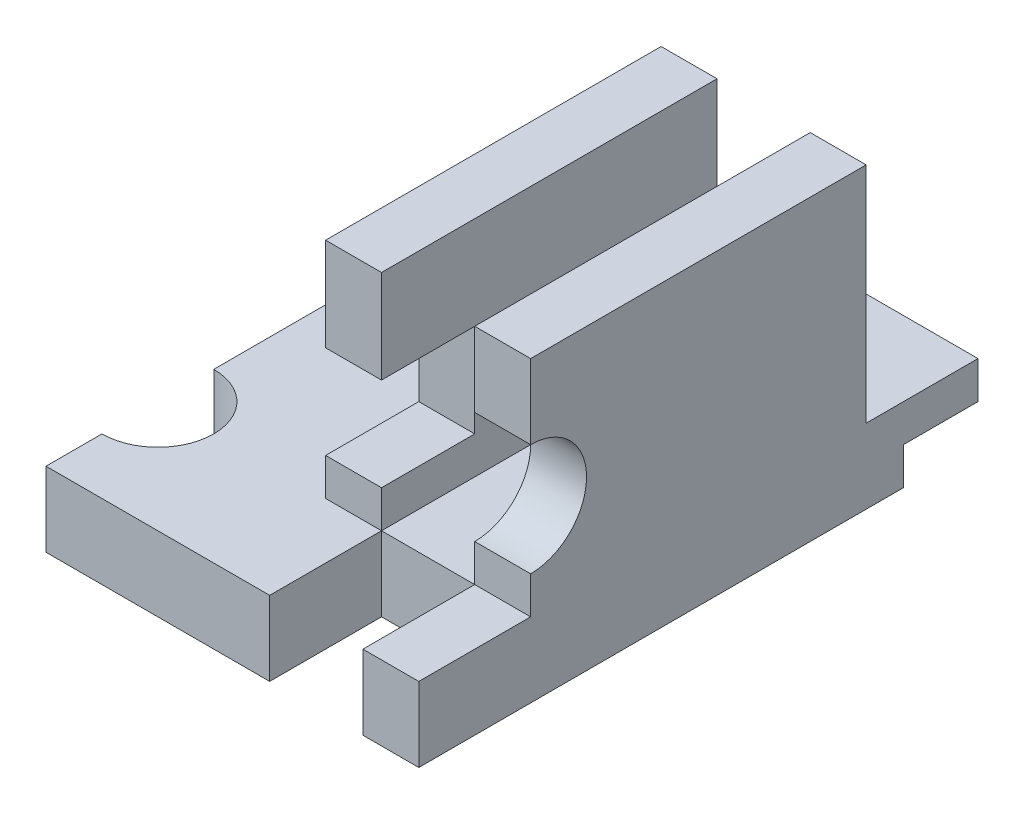
from build123d import *

# Parameters (mm, degrees)
SKETCH_1_W          = 100
SKETCH_1_H          = 150
EXTRUDE_1_DEPTH     = 20
SKETCH_2_R          = 15
CUT_EXTRUDE_1_DEPTH = 20
SKETCH_3_W          = 25
SKETCH_3_H          = 30
CUT_EXTRUDE_2_DEPTH = 20
SKETCH_4_W          = 15
SKETCH_4_H          = 90
EXTRUDE_2_DEPTH     = 60
SKETCH_6_W          = 15
SKETCH_6_H          = 90
EXTRUDE_3_DEPTH     = 60
CUT_EXTRUDE_3_REACH = 140.654
CUT_EXTRUDE_4_REACH = 112.68
SKETCH_9_W          = 25
SKETCH_9_H          = 25
SKETCH_10_W         = 20
SKETCH_10_H         = 10
CUT_EXTRUDE_5_DEPTH = 139.654246239


with BuildPart() as part:
    # Эскиз1 → Бобышка-Вытянуть1 (new body)
    with BuildSketch(Plane(origin=(0, 0, 0), x_dir=(1, 0, 0), z_dir=(0, 1, 0))):
        Rectangle(SKETCH_1_W, SKETCH_1_H)
    extrude(amount=-EXTRUDE_1_DEPTH)

    # Эскиз2 → Вырез-Вытянуть1 (cut)
    with BuildSketch(Plane(origin=(0, 0, 0), x_dir=(1, 0, 0), z_dir=(0, 1, 0))):
        with Locations((-50, -45)):
            Circle(SKETCH_2_R)
    extrude(amount=-CUT_EXTRUDE_1_DEPTH, mode=Mode.SUBTRACT)

    # Эскиз3 → Вырез-Вытянуть2 (cut)
    with BuildSketch(Plane(origin=(0, 0, 0), x_dir=(1, 0, 0), z_dir=(0, 1, 0))):
        with Locations((22.5, -60)):
            Rectangle(SKETCH_3_W, SKETCH_3_H)
    extrude(amount=-CUT_EXTRUDE_2_DEPTH, mode=Mode.SUBTRACT)

    # Эскиз4 → Бобышка-Вытянуть2 (add)
    with BuildSketch(Plane(origin=(0, 0, 0), x_dir=(1, 0, 0), z_dir=(0, 1, 0))):
        with Locations((2.5, 0)):
            Rectangle(SKETCH_4_W, SKETCH_4_H)
    extrude(amount=EXTRUDE_2_DEPTH)

    # Эскиз6 → Бобышка-Вытянуть3 (add)
    with BuildSketch(Plane(origin=(0, 0, 0), x_dir=(1, 0, 0), z_dir=(0, 1, 0))):
        with Locations((42.5, 0)):
            Rectangle(SKETCH_6_W, SKETCH_6_H)
    extrude(amount=EXTRUDE_3_DEPTH)

    # Эскиз7 → Вырез-Вытянуть3 (cut, up to next)
    with BuildSketch(Plane(origin=(50, 0, 0), x_dir=(0, 0, -1), z_dir=(1, 0, 0)), mode=Mode.PRIVATE) as cut_extrude_3_sk1:
        with BuildLine():
            Line((-45, 40), (-45, 10))
            ThreePointArc((-45, 10), (-30, 25), (-45, 40))
        make_face()
    cut_extrude_3_tool1 = extrude(cut_extrude_3_sk1.sketch, amount=-CUT_EXTRUDE_3_REACH, mode=Mode.PRIVATE) & part.part
    add(cut_extrude_3_tool1.solids().sort_by_distance((50, 25, 38.633802))[0], mode=Mode.SUBTRACT)

    # Эскиз9 → Вырез-Вытянуть4 (cut, up to next)
    with BuildSketch(Plane.ZY.offset(5), mode=Mode.PRIVATE) as cut_extrude_4_sk1:
        with Locations((32.5, 22.5)):
            Rectangle(SKETCH_9_W, SKETCH_9_H)
    cut_extrude_4_tool1 = extrude(cut_extrude_4_sk1.sketch, amount=-CUT_EXTRUDE_4_REACH, mode=Mode.PRIVATE) & part.part
    add(cut_extrude_4_tool1.solids().sort_by_distance((-5, 22.5, 32.5))[0], mode=Mode.SUBTRACT)

    # Эскиз10 → Вырез-Вытянуть5 (cut, through all)
    with BuildSketch(Plane(origin=(50, 0, 0), x_dir=(0, 0, -1), z_dir=(1, 0, 0))):
        with Locations((65, -15)):
            Rectangle(SKETCH_10_W, SKETCH_10_H)
    extrude(amount=-CUT_EXTRUDE_5_DEPTH, mode=Mode.SUBTRACT)


solid = part.part
